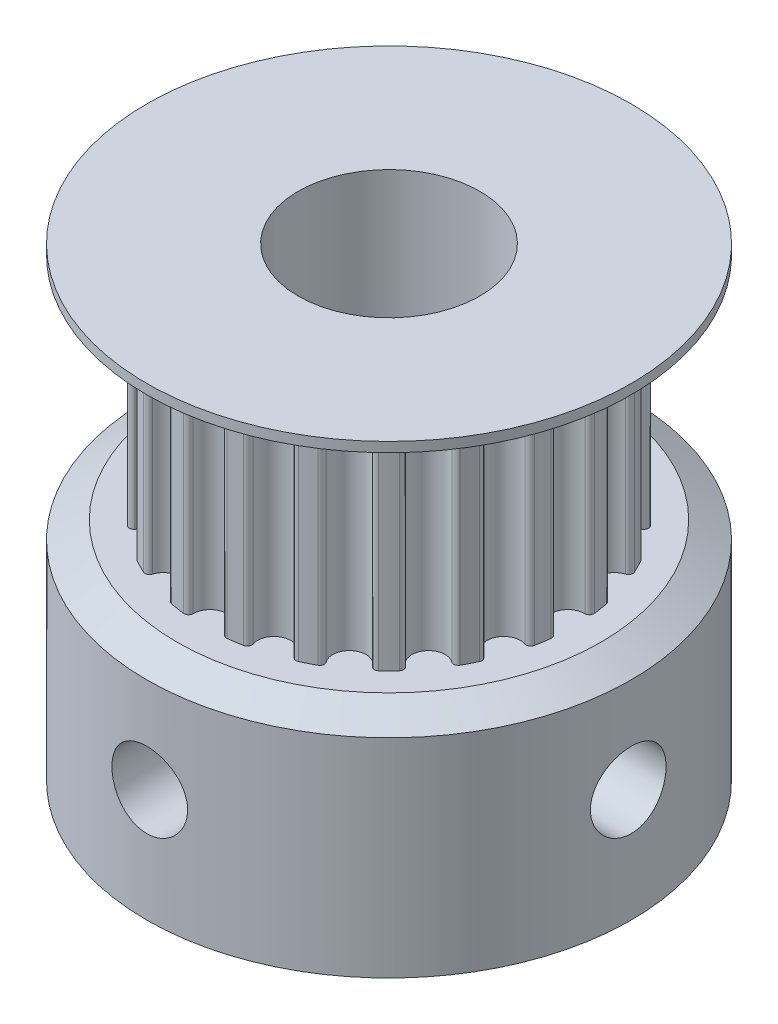
from build123d import *
from OCP.BRepFilletAPI import BRepFilletAPI_MakeChamfer

# Parameters (mm, degrees)
SKETCH_1_R               = 8
SKETCH_1_R_2             = 3
EXTRUDE_1_DEPTH          = 7.45
SKETCH_2_R               = 3
EXTRUDE_2_DEPTH          = 7
SKETCH_3_R               = 8
SKETCH_3_R_2             = 3
EXTRUDE_3_DEPTH          = 1.55
CUT_EXTRUDE_1_REACH      = 21.596
CUT_EXTRUDE_1_END_RADIUS = 8
SKETCH_4_R               = 1.25
CUT_EXTRUDE_2_REACH      = 21.596
CUT_EXTRUDE_2_END_RADIUS = 8
SKETCH_5_R               = 1.25
CHAMFER_1_SIZE           = 1
CHAMFER_1_SIZE2          = 0.577350269
CUT_EXTRUDE1_START       = -0.65
SKETCH1_R                = 8
CUT_EXTRUDE1_DEPTH       = 0.65


with BuildPart() as part:
    # Эскиз1 → Бобышка-Вытянуть1 (new body)
    with BuildSketch(Plane(origin=(0, 0, 0), x_dir=(1, 0, 0), z_dir=(0, 1, 0))):
        with Locations(Location((0, 0, 0), (0, 0, 270))):
            Circle(SKETCH_1_R)
        with Locations(Location((0, 0, 0), (0, 0, 270))):
            Circle(SKETCH_1_R_2, mode=Mode.SUBTRACT)
    extrude(amount=EXTRUDE_1_DEPTH)

    # Эскиз2 → Бобышка-Вытянуть2 (add)
    with BuildSketch(Plane(origin=(0, 7.45, 0), x_dir=(1, 0, 0), z_dir=(0, 1, 0))):
        with BuildLine():
            ThreePointArc((-2.557469435, 5.549004423), (-2.773881953, 5.444049863), (-2.985996064, 5.3306592))
            ThreePointArc((-2.985996064, 5.3306592), (-3.059404709, 5.231014138), (-3.032930262, 5.110113057))
            ThreePointArc((-3.032930262, 5.110113057), (-3.150528952, 4.33633109), (-3.922779328, 4.463599867))
            ThreePointArc((-3.922779328, 4.463599867), (-4.029582035, 4.526139051), (-4.14703464, 4.487115298))
            ThreePointArc((-4.14703464, 4.487115298), (-4.320422433, 4.320422433), (-4.487115298, 4.14703464))
            ThreePointArc((-4.487115298, 4.14703464), (-4.526139051, 4.029582035), (-4.463599867, 3.922779328))
            ThreePointArc((-4.463599867, 3.922779328), (-4.33633109, 3.150528952), (-5.110113057, 3.032930262))
            ThreePointArc((-5.110113057, 3.032930262), (-5.231014138, 3.059404709), (-5.3306592, 2.985996064))
            ThreePointArc((-5.3306592, 2.985996064), (-5.444049863, 2.773881953), (-5.549004423, 2.557469435))
            ThreePointArc((-5.549004423, 2.557469435), (-5.549823367, 2.433706366), (-5.457341217, 2.351456627))
            ThreePointArc((-5.457341217, 2.351456627), (-5.097662927, 1.65633109), (-5.797233315, 1.305376312))
            ThreePointArc((-5.797233315, 1.305376312), (-5.92039813, 1.293194518), (-5.992481697, 1.19258673))
            ThreePointArc((-5.992481697, 1.19258673), (-6.034775761, 0.955814581), (-6.067718334, 0.717561302))
            ThreePointArc((-6.067718334, 0.717561302), (-6.030252304, 0.599602562), (-5.916879985, 0.549956967))
            ThreePointArc((-5.916879985, 0.549956967), (-5.36, 0), (-5.916879985, -0.549956967))
            ThreePointArc((-5.916879985, -0.549956967), (-6.030252304, -0.599602562), (-6.067718334, -0.717561302))
            ThreePointArc((-6.067718334, -0.717561302), (-6.034775761, -0.955814581), (-5.992481697, -1.19258673))
            ThreePointArc((-5.992481697, -1.19258673), (-5.92039813, -1.293194518), (-5.797233315, -1.305376312))
            ThreePointArc((-5.797233315, -1.305376312), (-5.097662927, -1.65633109), (-5.457341217, -2.351456627))
            ThreePointArc((-5.457341217, -2.351456627), (-5.549823367, -2.433706366), (-5.549004423, -2.557469435))
            ThreePointArc((-5.549004423, -2.557469435), (-5.444049863, -2.773881953), (-5.3306592, -2.985996064))
            ThreePointArc((-5.3306592, -2.985996064), (-5.231014138, -3.059404709), (-5.110113057, -3.032930262))
            ThreePointArc((-5.110113057, -3.032930262), (-4.33633109, -3.150528952), (-4.463599867, -3.922779328))
            ThreePointArc((-4.463599867, -3.922779328), (-4.526139051, -4.029582035), (-4.487115298, -4.14703464))
            ThreePointArc((-4.487115298, -4.14703464), (-4.320422433, -4.320422433), (-4.14703464, -4.487115298))
            ThreePointArc((-4.14703464, -4.487115298), (-4.029582035, -4.526139051), (-3.922779328, -4.463599867))
            ThreePointArc((-3.922779328, -4.463599867), (-3.150528952, -4.33633109), (-3.032930262, -5.110113057))
            ThreePointArc((-3.032930262, -5.110113057), (-3.059404709, -5.231014138), (-2.985996064, -5.3306592))
            ThreePointArc((-2.985996064, -5.3306592), (-2.773881953, -5.444049863), (-2.557469435, -5.549004423))
            ThreePointArc((-2.557469435, -5.549004423), (-2.433706366, -5.549823367), (-2.351456627, -5.457341217))
            ThreePointArc((-2.351456627, -5.457341217), (-1.65633109, -5.097662927), (-1.305376312, -5.797233315))
            ThreePointArc((-1.305376312, -5.797233315), (-1.293194518, -5.92039813), (-1.19258673, -5.992481697))
            ThreePointArc((-1.19258673, -5.992481697), (-0.955814581, -6.034775761), (-0.717561302, -6.067718334))
            ThreePointArc((-0.717561302, -6.067718334), (-0.599602562, -6.030252304), (-0.549956967, -5.916879985))
            ThreePointArc((-0.549956967, -5.916879985), (0, -5.36), (0.549956967, -5.916879985))
            ThreePointArc((0.549956967, -5.916879985), (0.599602562, -6.030252304), (0.717561302, -6.067718334))
            ThreePointArc((0.717561302, -6.067718334), (0.955814581, -6.034775761), (1.19258673, -5.992481697))
            ThreePointArc((1.19258673, -5.992481697), (1.293194518, -5.92039813), (1.305376312, -5.797233315))
            ThreePointArc((1.305376312, -5.797233315), (1.65633109, -5.097662927), (2.351456627, -5.457341217))
            ThreePointArc((2.351456627, -5.457341217), (2.433706366, -5.549823367), (2.557469435, -5.549004423))
            ThreePointArc((2.557469435, -5.549004423), (2.773881953, -5.444049863), (2.985996064, -5.3306592))
            ThreePointArc((2.985996064, -5.3306592), (3.059404709, -5.231014138), (3.032930262, -5.110113057))
            ThreePointArc((3.032930262, -5.110113057), (3.150528952, -4.33633109), (3.922779328, -4.463599867))
            ThreePointArc((3.922779328, -4.463599867), (4.029582035, -4.526139051), (4.14703464, -4.487115298))
            ThreePointArc((4.14703464, -4.487115298), (4.320422433, -4.320422433), (4.487115298, -4.14703464))
            ThreePointArc((4.487115298, -4.14703464), (4.526139051, -4.029582035), (4.463599867, -3.922779328))
            ThreePointArc((4.463599867, -3.922779328), (4.33633109, -3.150528952), (5.110113057, -3.032930262))
            ThreePointArc((5.110113057, -3.032930262), (5.231014138, -3.059404709), (5.3306592, -2.985996064))
            ThreePointArc((5.3306592, -2.985996064), (5.444049863, -2.773881953), (5.549004423, -2.557469435))
            ThreePointArc((5.549004423, -2.557469435), (5.549823367, -2.433706366), (5.457341217, -2.351456627))
            ThreePointArc((5.457341217, -2.351456627), (5.097662927, -1.65633109), (5.797233315, -1.305376312))
            ThreePointArc((5.797233315, -1.305376312), (5.92039813, -1.293194518), (5.992481697, -1.19258673))
            ThreePointArc((5.992481697, -1.19258673), (6.034775761, -0.955814581), (6.067718334, -0.717561302))
            ThreePointArc((6.067718334, -0.717561302), (6.030252304, -0.599602562), (5.916879985, -0.549956967))
            ThreePointArc((5.916879985, -0.549956967), (5.36, 0), (5.916879985, 0.549956967))
            ThreePointArc((5.916879985, 0.549956967), (6.030252304, 0.599602562), (6.067718334, 0.717561302))
            ThreePointArc((6.067718334, 0.717561302), (6.034775761, 0.955814581), (5.992481697, 1.19258673))
            ThreePointArc((5.992481697, 1.19258673), (5.92039813, 1.293194518), (5.797233315, 1.305376312))
            ThreePointArc((5.797233315, 1.305376312), (5.097662927, 1.65633109), (5.457341217, 2.351456627))
            ThreePointArc((5.457341217, 2.351456627), (5.549823367, 2.433706366), (5.549004423, 2.557469435))
            ThreePointArc((5.549004423, 2.557469435), (5.444049863, 2.773881953), (5.3306592, 2.985996064))
            ThreePointArc((5.3306592, 2.985996064), (5.231014138, 3.059404709), (5.110113057, 3.032930262))
            ThreePointArc((5.110113057, 3.032930262), (4.33633109, 3.150528952), (4.463599867, 3.922779328))
            ThreePointArc((4.463599867, 3.922779328), (4.526139051, 4.029582035), (4.487115298, 4.14703464))
            ThreePointArc((4.487115298, 4.14703464), (4.320422433, 4.320422433), (4.14703464, 4.487115298))
            ThreePointArc((4.14703464, 4.487115298), (4.029582035, 4.526139051), (3.922779328, 4.463599867))
            ThreePointArc((3.922779328, 4.463599867), (3.150528952, 4.33633109), (3.032930262, 5.110113057))
            ThreePointArc((3.032930262, 5.110113057), (3.059404709, 5.231014138), (2.985996064, 5.3306592))
            ThreePointArc((2.985996064, 5.3306592), (2.773881953, 5.444049863), (2.557469435, 5.549004423))
            ThreePointArc((2.557469435, 5.549004423), (2.433706366, 5.549823367), (2.351456627, 5.457341217))
            ThreePointArc((2.351456627, 5.457341217), (1.65633109, 5.097662927), (1.305376312, 5.797233315))
            ThreePointArc((1.305376312, 5.797233315), (1.293194518, 5.92039813), (1.19258673, 5.992481697))
            ThreePointArc((1.19258673, 5.992481697), (0.955814581, 6.034775761), (0.717561302, 6.067718334))
            ThreePointArc((0.717561302, 6.067718334), (0.599602562, 6.030252304), (0.549956967, 5.916879985))
            ThreePointArc((0.549956967, 5.916879985), (0, 5.36), (-0.549956967, 5.916879985))
            ThreePointArc((-0.549956967, 5.916879985), (-0.599602562, 6.030252304), (-0.717561302, 6.067718334))
            ThreePointArc((-0.717561302, 6.067718334), (-0.955814581, 6.034775761), (-1.19258673, 5.992481697))
            ThreePointArc((-1.19258673, 5.992481697), (-1.293194518, 5.92039813), (-1.305376312, 5.797233315))
            ThreePointArc((-1.305376312, 5.797233315), (-1.65633109, 5.097662927), (-2.351456627, 5.457341217))
            ThreePointArc((-2.351456627, 5.457341217), (-2.433706366, 5.549823367), (-2.557469435, 5.549004423))
        make_face()
        with Locations(Location((0, 0, 0), (0, 0, 270))):
            Circle(SKETCH_2_R, mode=Mode.SUBTRACT)
    extrude(amount=EXTRUDE_2_DEPTH)

    # Эскиз3 → Бобышка-Вытянуть3 (add)
    with BuildSketch(Plane(origin=(0, 14.45, 0), x_dir=(1, 0, 0), z_dir=(0, 1, 0))):
        with Locations(Location((0, 0, 0), (0, 0, 270))):
            Circle(SKETCH_3_R)
        with Locations(Location((0, 0, 0), (0, 0, 270))):
            Circle(SKETCH_3_R_2, mode=Mode.SUBTRACT)
    extrude(amount=EXTRUDE_3_DEPTH)

    # Вырез-Вытянуть1: up to this cylinder (the profile starts inside it)
    cut_extrude_1_end = Plane(origin=(0, 3.725, 0), z_dir=(0, -1, 0)) * Cylinder(CUT_EXTRUDE_1_END_RADIUS, 60.192, mode=Mode.PRIVATE)
    # Эскиз4 → Вырез-Вытянуть1 (cut, up to the surface)
    with BuildSketch(Plane.XY, mode=Mode.PRIVATE) as cut_extrude_1_sk1:
        with Locations(Location((0, 3.725, 0), (0, 0, 180))):
            Circle(SKETCH_4_R)
    cut_extrude_1_tool1 = extrude(cut_extrude_1_sk1.sketch, amount=CUT_EXTRUDE_1_REACH, mode=Mode.PRIVATE) & cut_extrude_1_end
    add(cut_extrude_1_tool1.solids().sort_by_distance((0, 3.725, 0))[0], mode=Mode.SUBTRACT)

    # Вырез-Вытянуть2: up to this cylinder (the profile starts inside it)
    cut_extrude_2_end = Plane(origin=(0, 3.725, 0), z_dir=(0, -1, 0)) * Cylinder(CUT_EXTRUDE_2_END_RADIUS, 60.192, mode=Mode.PRIVATE)
    # Эскиз5 → Вырез-Вытянуть2 (cut, up to the surface)
    with BuildSketch(Plane(origin=(0, 0, 0), x_dir=(0, 0, -1), z_dir=(1, 0, 0)), mode=Mode.PRIVATE) as cut_extrude_2_sk1:
        with Locations(Location((0, 3.725, 0), (0, 0, 180))):
            Circle(SKETCH_5_R)
    cut_extrude_2_tool1 = extrude(cut_extrude_2_sk1.sketch, amount=CUT_EXTRUDE_2_REACH, mode=Mode.PRIVATE) & cut_extrude_2_end
    add(cut_extrude_2_tool1.solids().sort_by_distance((0, 3.725, 0))[0], mode=Mode.SUBTRACT)

    # Фаска1: one chamfer whose edges measure the first distance from different faces: ONE call of the kernel's chamfer builder (chamfer() names one face for all edges)
    chamfer_1_edges_1 = [part.edges().sort_by_distance(p)[0] for p in [
        (0, 14.45, -8),
    ]]
    chamfer_1_side_1 = [part.faces().sort_by_distance(p)[0] for p in [
        (0, 14.45, -7.77372583),
    ]]
    chamfer_1_edges_2 = [part.edges().sort_by_distance(p)[0] for p in [
        (0, 7.45, -8),
    ]]
    chamfer_1_side_2 = [part.faces().sort_by_distance(p)[0] for p in [
        (0, 7.45, -7.77372583),
    ]]
    chamfer_1 = BRepFilletAPI_MakeChamfer(part.part.solid().wrapped)
    for e in chamfer_1_edges_1:
        chamfer_1.Add(CHAMFER_1_SIZE, CHAMFER_1_SIZE2, e.wrapped, chamfer_1_side_1[0].wrapped)  # the first distance lies on this face
    for e in chamfer_1_edges_2:
        chamfer_1.Add(CHAMFER_1_SIZE, CHAMFER_1_SIZE2, e.wrapped, chamfer_1_side_2[0].wrapped)  # the first distance lies on this face
    add(Compound.cast(chamfer_1.Shape()), mode=Mode.REPLACE)

    # Sketch1 → Cut-Extrude1 (cut)
    with BuildSketch(Plane(origin=(0, 16, 0), x_dir=(1, 0, 0), z_dir=(0, 1, 0)).offset(CUT_EXTRUDE1_START)):
        with Locations(Location((0, 0, 0), (0, 0, 90))):
            Circle(SKETCH1_R)
    extrude(amount=CUT_EXTRUDE1_DEPTH, mode=Mode.SUBTRACT)


solid = part.part
